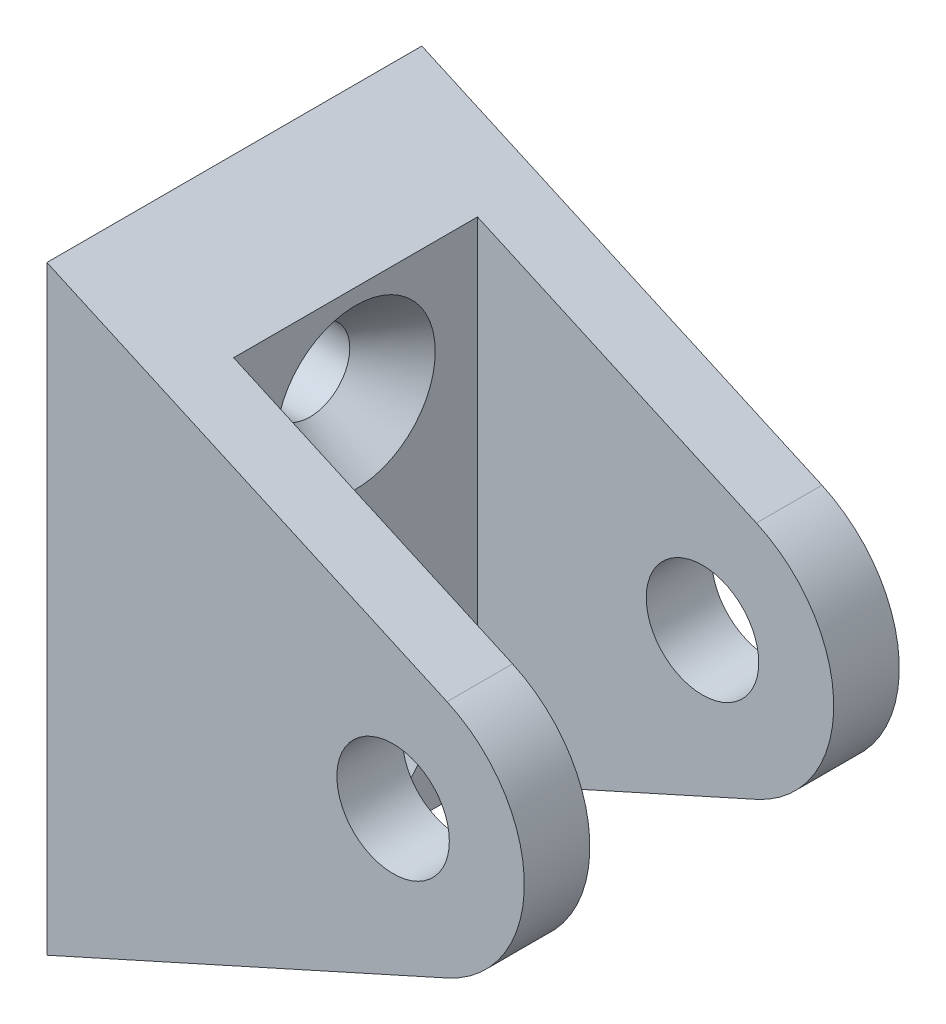
from build123d import *

# Parameters (mm, degrees)
CAMBER_BLOCK_EXTRUDE_DEPTH                          = 50.8
CSK_FOR_1_4_FLAT_HEAD_MACHINE_SCREW_100_D           = 6.7564
CSK_FOR_1_4_FLAT_HEAD_MACHINE_SCREW_100_CSINK_D     = 13.4874
CSK_FOR_1_4_FLAT_HEAD_MACHINE_SCREW_100_CSINK_ANGLE = 82
CUT_EXTRUDE1_REACH                                  = 75.171
SKETCH5_R                                           = 4.7625


with BuildPart() as part:
    # Sketch1 → Camber Block Extrude (new body)
    with BuildSketch(Plane(origin=(0, 0, 0), x_dir=(1, 0, 0), z_dir=(0, 1, 0))):
        Polygon((0, 0), (42.015665571, 0), (42.015665571, 5.5499), (10.265665571, 5.5499), (10.265665571, 26.2001), (42.015665571, 26.2001), (42.015665571, 31.75), (0, 31.75), align=None)
    extrude(amount=CAMBER_BLOCK_EXTRUDE_DEPTH)

    # CSK for 1/4 Flat Head Machine Screw (100)1 (through all)
    with Locations(Plane(origin=(10.265665571, 0, 0), x_dir=(0, 0, -1), z_dir=(1, 0, 0))):
        with Locations((15.875, 12.7), (15.875, 38.1)):
            CounterSinkHole(CSK_FOR_1_4_FLAT_HEAD_MACHINE_SCREW_100_D / 2, CSK_FOR_1_4_FLAT_HEAD_MACHINE_SCREW_100_CSINK_D / 2, counter_sink_angle=CSK_FOR_1_4_FLAT_HEAD_MACHINE_SCREW_100_CSINK_ANGLE)

    # Cut-Extrude1: up to this face of the body (flat: up to its plane)
    cut_extrude1_end = Plane(part.part.faces().sort_by_distance((21.007832786, 25.4, -31.75))[0])
    # Sketch5 → Cut-Extrude1 (cut, up to the picked face)
    with BuildSketch(Plane.XY, mode=Mode.PRIVATE) as cut_extrude1_sk1:
        with Locations((29.315665571, 25.4)):
            Circle(SKETCH5_R)
    cut_extrude1_tool1 = split(extrude(cut_extrude1_sk1.sketch, amount=-CUT_EXTRUDE1_REACH, mode=Mode.PRIVATE), bisect_by=cut_extrude1_end, keep=Keep.BOTH, mode=Mode.PRIVATE)
    # Sketch5 → Cut-Extrude1 (cut, up to the picked face)
    with BuildSketch(Plane.XY, mode=Mode.PRIVATE) as cut_extrude1_sk2:
        with BuildLine():
            Line((0, 0), (33.881349019, 15.26875176))
            ThreePointArc((33.881349019, 15.26875176), (40.428165571, 25.4), (33.881349019, 35.53124824))
            Line((33.881349019, 35.53124824), (0, 50.8))
            Line((0, 50.8), (42.015665571, 50.8))
            Line((42.015665571, 50.8), (42.015665571, 0))
            Line((42.015665571, 0), (0, 0))
        make_face()
    cut_extrude1_tool2 = split(extrude(cut_extrude1_sk2.sketch, amount=-CUT_EXTRUDE1_REACH, mode=Mode.PRIVATE), bisect_by=cut_extrude1_end, keep=Keep.BOTH, mode=Mode.PRIVATE)
    add(cut_extrude1_tool1.solids().sort_by(Axis((29.315666, 25.4, 0), (0, 0, -1)))[0], mode=Mode.SUBTRACT)
    add(cut_extrude1_tool2.solids().sort_by(Axis((17.211529, 7.033349, 0), (0, 0, -1)))[0], mode=Mode.SUBTRACT)


solid = part.part
